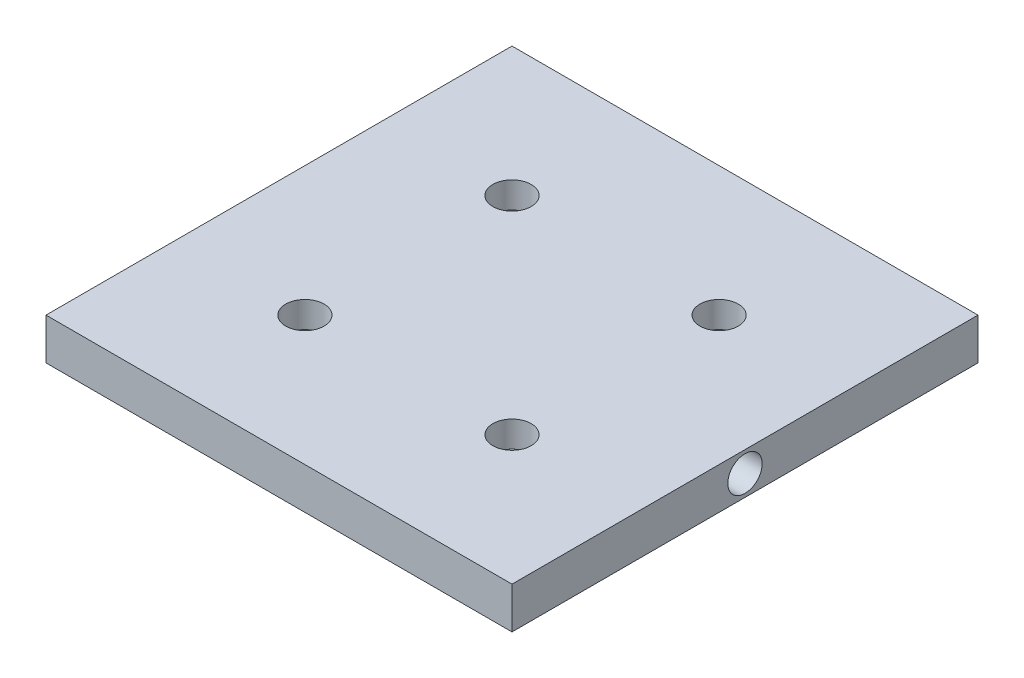
from build123d import *

# Parameters (mm, degrees)
SKETCH1_W                      = 114.3
SKETCH1_H                      = 114.3
BOSS_EXTRUDE1_DEPTH            = 10.16
CBORE_FOR_M6_SHCS1_D           = 6.6
CBORE_FOR_M6_SHCS1_CBORE_D     = 9.4
CBORE_FOR_M6_SHCS1_CBORE_DEPTH = 6.4
SKETCH6_R                      = 4.2164
CUT_EXTRUDE1_DEPTH             = 13.97


with BuildPart() as part:
    # Sketch1 → Boss-Extrude1 (new body)
    with BuildSketch(Plane(origin=(0, 0, 0), x_dir=(1, 0, 0), z_dir=(0, 1, 0))):
        Rectangle(SKETCH1_W, SKETCH1_H)
    extrude(amount=BOSS_EXTRUDE1_DEPTH)

    # CBORE for M6 SHCS1 (through all)
    with Locations(Plane(origin=(0, 10.16, 0), x_dir=(1, 0, 0), z_dir=(0, 1, 0))):
        with Locations((-25.4, 25.4), (25.4, 25.4), (25.4, -25.4), (-25.4, -25.4)):
            CounterBoreHole(CBORE_FOR_M6_SHCS1_D / 2, CBORE_FOR_M6_SHCS1_CBORE_D / 2, CBORE_FOR_M6_SHCS1_CBORE_DEPTH)

    # Sketch6 → Cut-Extrude1 (cut)
    with BuildSketch(Plane(origin=(57.15, 0, 0), x_dir=(0, 0, -1), z_dir=(1, 0, 0))):
        with Locations((0, 5.08)):
            Circle(SKETCH6_R)
    extrude(amount=-CUT_EXTRUDE1_DEPTH, mode=Mode.SUBTRACT)


solid = part.part
